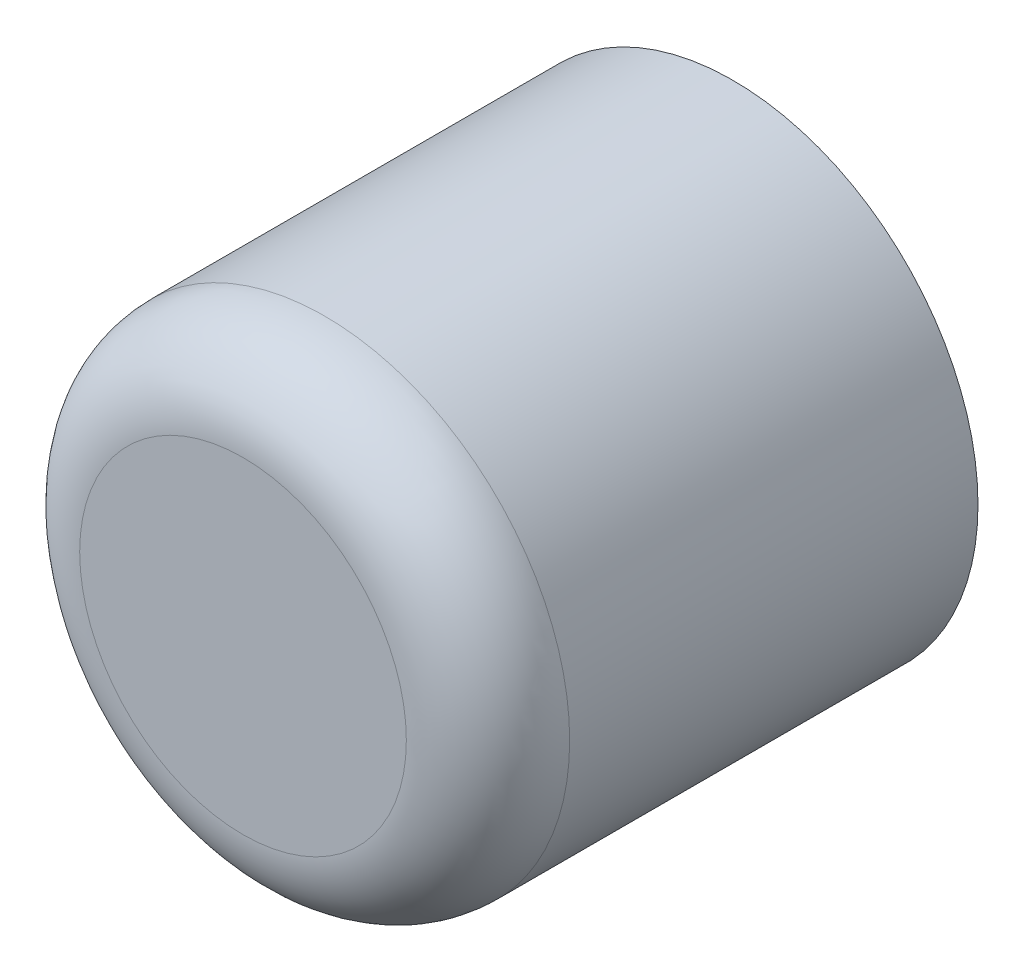
from build123d import *

# Parameters (mm, degrees)
SKETCH_1_R          = 3
EXTRUDE_1_DEPTH     = 6
FILLET_1_R          = 1
CUT_EXTRUDE_1_DEPTH = 1.5


with BuildPart() as part:
    # 草图1 → 凸台-拉伸1 (new body)
    with BuildSketch(Plane.XY):
        Circle(SKETCH_1_R)
    extrude(amount=EXTRUDE_1_DEPTH)

    # 圆角1
    fillet_1_edges = [part.edges().sort_by_distance(p)[0] for p in [
        (-3, 0, 6),
    ]]
    fillet(fillet_1_edges, radius=FILLET_1_R)

    # 草图2 → 切除-拉伸1 (cut)
    with BuildSketch(Plane(origin=(0, 0, 0), x_dir=(-1, 0, 0), z_dir=(0, 0, -1))):
        Polygon((1.732050808, 0), (0.866025404, 1.5), (-0.866025404, 1.5), (-1.732050808, 0), (-0.866025404, -1.5), (0.866025404, -1.5), align=None)
    extrude(amount=-CUT_EXTRUDE_1_DEPTH, mode=Mode.SUBTRACT)


solid = part.part
